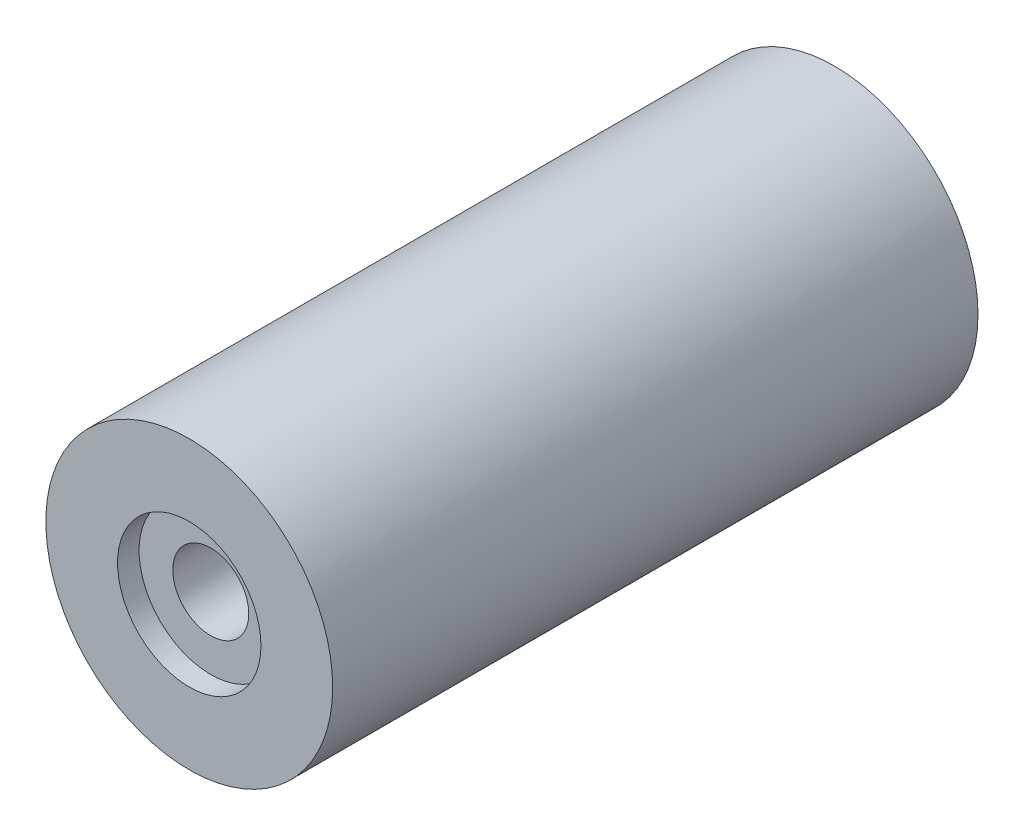
from build123d import *

# Parameters (mm, degrees)
SKETCH1_R           = 10
BOSS_EXTRUDE1_DEPTH = 45
SKETCH2_R           = 2.65
CUT_EXTRUDE1_DEPTH  = 48.16990566
SKETCH3_R           = 5
CUT_EXTRUDE2_DEPTH  = 1.5


with BuildPart() as part:
    # Sketch1 → Boss-Extrude1 (new body)
    with BuildSketch(Plane.XY):
        Circle(SKETCH1_R)
    extrude(amount=-BOSS_EXTRUDE1_DEPTH)

    # Sketch2 → Cut-Extrude1 (cut, through all)
    with BuildSketch(Plane.XY):
        Circle(SKETCH2_R)
    extrude(amount=-CUT_EXTRUDE1_DEPTH, mode=Mode.SUBTRACT)

    # Sketch3 → Cut-Extrude2 (cut)
    with BuildSketch(Plane.XY):
        Circle(SKETCH3_R)
    extrude(amount=-CUT_EXTRUDE2_DEPTH, mode=Mode.SUBTRACT)


solid = part.part
